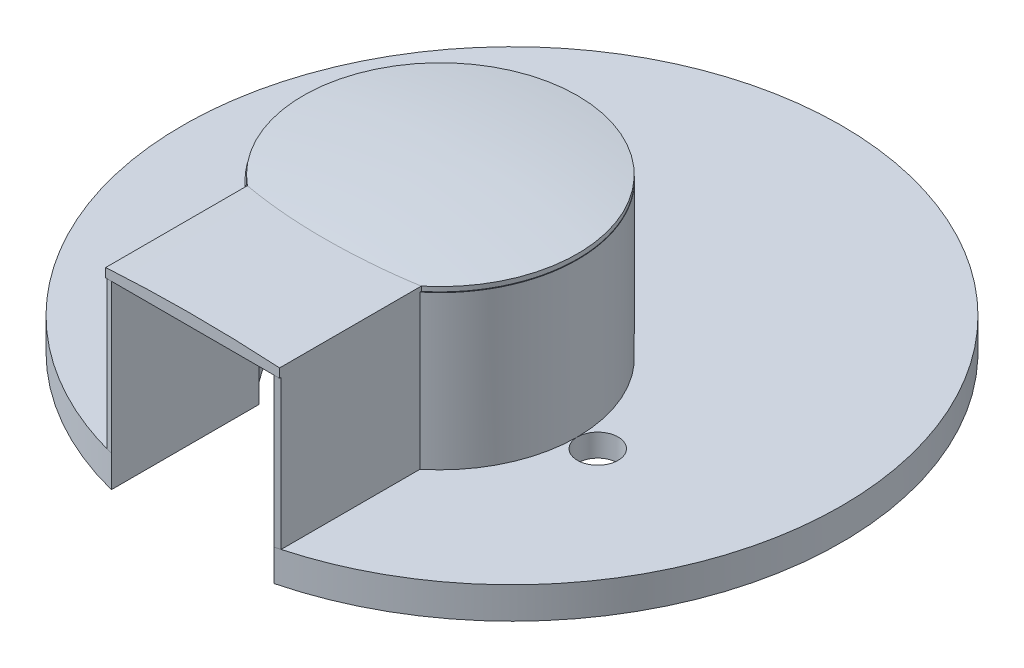
from build123d import *

# Parameters (mm, degrees)
BOSS_EXTRUDE1_DEPTH = 3.5
CUT_EXTRUDE1_DEPTH  = 1
SKETCH4_R           = 2.25
CUT_EXTRUDE2_DEPTH  = 3
SKETCH4_2_R         = 2.25
CUT_EXTRUDE3_DEPTH  = 8
BOSS_EXTRUDE4_DEPTH = 17
BOSS_EXTRUDE5_DEPTH = 16
FILLET5_R           = 0.3


with BuildPart() as part:
    # Sketch1 → Boss-Extrude1 (new body)
    with BuildSketch(Plane(origin=(0, 0, 0), x_dir=(1, 0, 0), z_dir=(0, 1, 0))):
        with BuildLine():
            Line((-9, -19.048189897), (-9, -35.373012312))
            ThreePointArc((-9, -35.373012312), (0, 36.5), (9, -35.373012312))
            Line((9, -35.373012312), (9, -19.048189897))
            ThreePointArc((9, -19.048189897), (0, 6.25), (-9, -19.048189897))
        make_face()
    extrude(amount=BOSS_EXTRUDE1_DEPTH)

    # Sketch2 → Cut-Extrude1 (cut)
    with BuildSketch(Plane(origin=(0, 0, 0), x_dir=(1, 0, 0), z_dir=(0, 1, 0))):
        with BuildLine():
            Line((-17.5, -4.25), (17.5, -4.25))
            ThreePointArc((17.5, -4.25), (21.25, -8), (17.5, -11.75))
            Line((17.5, -11.75), (-17.5, -11.75))
            ThreePointArc((-17.5, -11.75), (-21.25, -8), (-17.5, -4.25))
        make_face()
    extrude(amount=CUT_EXTRUDE1_DEPTH, mode=Mode.SUBTRACT)

    # Sketch4 → Cut-Extrude2 (cut)
    with BuildSketch(Plane(origin=(0, 0, 0), x_dir=(1, 0, 0), z_dir=(0, 1, 0))):
        with Locations((17.5, -8)):
            Circle(SKETCH4_R)
        with Locations((-17.5, -8)):
            Circle(SKETCH4_R)
    extrude(amount=CUT_EXTRUDE2_DEPTH, mode=Mode.SUBTRACT)

    # Sketch4<2> → Cut-Extrude3 (cut)
    with BuildSketch(Plane(origin=(0, 0, 0), x_dir=(1, 0, 0), z_dir=(0, 1, 0))):
        with Locations((17.5, -8)):
            Circle(SKETCH4_2_R)
        with Locations((-17.5, -8)):
            Circle(SKETCH4_2_R)
    extrude(amount=CUT_EXTRUDE3_DEPTH, mode=Mode.SUBTRACT)

    # Sketch8 → Boss-Extrude4 (add)
    with BuildSketch(Plane(origin=(0, 3.5, 0), x_dir=(1, 0, 0), z_dir=(0, 1, 0))):
        with BuildLine():
            Line((-9.631578947, -19.823501469), (-9.631578947, -35.206287606))
            Line((-9.631578947, -35.206287606), (-9, -35.373012312))
            Line((-9, -35.373012312), (-9, -19.048189897))
            ThreePointArc((-9, -19.048189897), (0, 6.25), (9, -19.048189897))
            Line((9, -19.048189897), (9, -35.373012312))
            Line((9, -35.373012312), (9.631578947, -35.206287606))
            Line((9.631578947, -35.206287606), (9.631578947, -19.823501469))
            ThreePointArc((9.631578947, -19.823501469), (0, 7.25), (-9.631578947, -19.823501469))
        make_face()
    extrude(amount=BOSS_EXTRUDE4_DEPTH)

    # Sketch10 → Revolve1 (revolve)
    with BuildSketch(Plane(origin=(0, 0, 0), x_dir=(0, 0, -1), z_dir=(1, 0, 0))):
        with BuildLine():
            Line((7.25, 20.5), (7.25, 21))
            add(Edge.make_bspline(
                [(-7.936369454, 22.1), (-0.307195454, 22.047396127), (7.25, 21)],
                knots=[0, 0, 0, 1, 1, 1], degree=2))
            Line((-7.936369454, 22.1), (-7.936369454, 21.1))
            add(Edge.make_bspline(
                [(-7.936369454, 21.1), (-1.085621259, 20.96742236), (5.75, 20.5)],
                knots=[0, 0, 0, 1, 1, 1], degree=2))
            Line((5.75, 20.5), (7.25, 20.5))
        make_face()
    revolve(axis=Axis((0, 22.1, 7.936369454), (0, -1, 0)))

    # Sketch11 → Boss-Extrude5 (add)
    with BuildSketch(Plane(origin=(0, 0, 35.373012312), x_dir=(-1, 0, 0), z_dir=(0, 0, -1))):
        with BuildLine():
            Line((9.631578947, 21.000000084), (9.631578947, 19.999999916))
            Line((9.631578947, 19.999999916), (-9.631578947, 19.999999916))
            Line((-9.631578947, 19.999999916), (-9.631578947, 20.999999916))
            add(Edge.make_bspline(
                [(9.631578947, 21.000000084), (-5e-09, 21.599999831), (-9.631578947, 20.999999916)],
                knots=[0, 0, 0, 1, 1, 1], degree=2))
        make_face()
    extrude(amount=BOSS_EXTRUDE5_DEPTH)

    # Fillet5
    fillet5_edges = [part.edges().sort_by_distance(p)[0] for p in [
        (0, 19.999999916, 19.373012312),
    ]]
    fillet(fillet5_edges, radius=FILLET5_R)


solid = part.part
